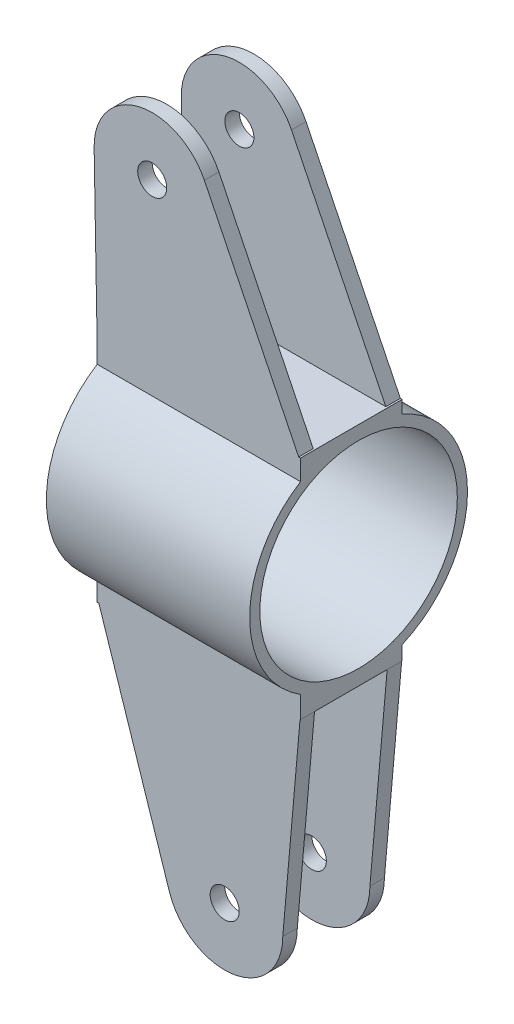
from build123d import *

# Parameters (mm, degrees)
SKETCH1_R             = 37.5
SKETCH1_R_2           = 34
BOSS_EXTRUDE1_DEPTH   = 35
BOSS_EXTRUDE2_START   = 15
SKETCH2_R             = 5
BOSS_EXTRUDE2_DEPTH   = 5
BOSS_EXTRUDE2_2_DEPTH = 5
BOSS_EXTRUDE3_START   = -15
SKETCH2_2_R           = 5
BOSS_EXTRUDE3_DEPTH   = 5
BOSS_EXTRUDE3_2_DEPTH = 5
BOSS_EXTRUDE4_DEPTH   = 70
BOSS_EXTRUDE5_START   = -70
BOSS_EXTRUDE5_DEPTH   = 70


with BuildPart() as part:
    # Sketch1 → Boss-Extrude1 (new, symmetric)
    with BuildSketch(Plane(origin=(0, 0, 0), x_dir=(0, 0, -1), z_dir=(1, 0, 0))):
        Circle(SKETCH1_R)
        Circle(SKETCH1_R_2, mode=Mode.SUBTRACT)
    extrude(amount=BOSS_EXTRUDE1_DEPTH, both=True)



with BuildPart() as body_2:
    # Sketch2 → Boss-Extrude2 (new body)
    with BuildSketch(Plane.XY.offset(BOSS_EXTRUDE2_START)):
        with BuildLine():
            Line((-36.046360502, 95.880386994), (-35, 37.5))
            Line((-35, 37.5), (35, 37.5))
            Line((35, 37.5), (1.90425986, 105.037379634))
            ThreePointArc((1.90425986, 105.037379634), (-20.743145305, 115.677666176), (-36.046360502, 95.880386994))
        make_face()
        with Locations((-16.052783226, 96.238734902)):
            Circle(SKETCH2_R, mode=Mode.SUBTRACT)
    extrude(amount=BOSS_EXTRUDE2_DEPTH)


with BuildPart() as body_3:
    # Sketch2 → Boss-Extrude2 2 (new body)
    with BuildSketch(Plane.XY.offset(BOSS_EXTRUDE2_START)):
        with BuildLine():
            Line((-35, -37.5), (35, -37.5))
            Line((35, -37.5), (28.89703955, -106.961265098))
            ThreePointArc((28.89703955, -106.961265098), (12.060917272, -126.709426475), (-10.101948226, -113.209341881))
            Line((-10.101948226, -113.209341881), (-35, -37.5))
        make_face()
        with Locations((8.89703955, -106.961265098)):
            Circle(SKETCH2_R, mode=Mode.SUBTRACT)
    extrude(amount=BOSS_EXTRUDE2_2_DEPTH)


with BuildPart() as body_4:
    # Sketch2<2> → Boss-Extrude3 (new body)
    with BuildSketch(Plane.XY.offset(BOSS_EXTRUDE3_START)):
        with BuildLine():
            Line((-36.046360502, 95.880386994), (-35, 37.5))
            Line((-35, 37.5), (35, 37.5))
            Line((35, 37.5), (1.90425986, 105.037379634))
            ThreePointArc((1.90425986, 105.037379634), (-20.743145305, 115.677666176), (-36.046360502, 95.880386994))
        make_face()
        with Locations((-16.052783226, 96.238734902)):
            Circle(SKETCH2_2_R, mode=Mode.SUBTRACT)
    extrude(amount=BOSS_EXTRUDE3_DEPTH)


with BuildPart() as body_5:
    # Sketch2<2> → Boss-Extrude3 2 (new body)
    with BuildSketch(Plane.XY.offset(BOSS_EXTRUDE3_START)):
        with BuildLine():
            Line((-35, -37.5), (35, -37.5))
            Line((35, -37.5), (28.89703955, -106.961265098))
            ThreePointArc((28.89703955, -106.961265098), (12.060917272, -126.709426475), (-10.101948226, -113.209341881))
            Line((-10.101948226, -113.209341881), (-35, -37.5))
        make_face()
        with Locations((8.89703955, -106.961265098)):
            Circle(SKETCH2_2_R, mode=Mode.SUBTRACT)
    extrude(amount=BOSS_EXTRUDE3_2_DEPTH)


with BuildPart() as part_1:
    add(part.part)

    add(body_2.part)  # Boss-Extrude4 merges body 2

    add(body_4.part)  # Boss-Extrude4 merges body 4
    # Sketch3 → Boss-Extrude4 (add)
    with BuildSketch(Plane(origin=(35, 0, 0), x_dir=(0, 0, -1), z_dir=(1, 0, 0))):
        with BuildLine():
            Line((-20, 37.5), (-20, 31.721443851))
            ThreePointArc((-20, 31.721443851), (-2.828923646, 37.393143636), (15, 34.369317712))
            Line((15, 34.369317712), (15, 37.5))
            Line((15, 37.5), (15, 38.756727822))
            Line((15, 38.756727822), (-20, 38.756727822))
            Line((-20, 38.756727822), (-20, 37.5))
        make_face()
    extrude(amount=-BOSS_EXTRUDE4_DEPTH)


    add(body_3.part)  # Boss-Extrude5 merges body 3

    add(body_5.part)  # Boss-Extrude5 merges body 5
    # Sketch4 → Boss-Extrude5 (add)
    with BuildSketch(Plane.ZY.offset(35).offset(BOSS_EXTRUDE5_START)):
        with BuildLine():
            Line((-15, -39.232593617), (20, -39.232593617))
            Line((20, -39.232593617), (20, -31.721443851))
            ThreePointArc((20, -31.721443851), (2.828923646, -37.393143636), (-15, -34.369317712))
            Line((-15, -34.369317712), (-15, -39.232593617))
        make_face()
    extrude(amount=BOSS_EXTRUDE5_DEPTH)


solid = part_1.part
